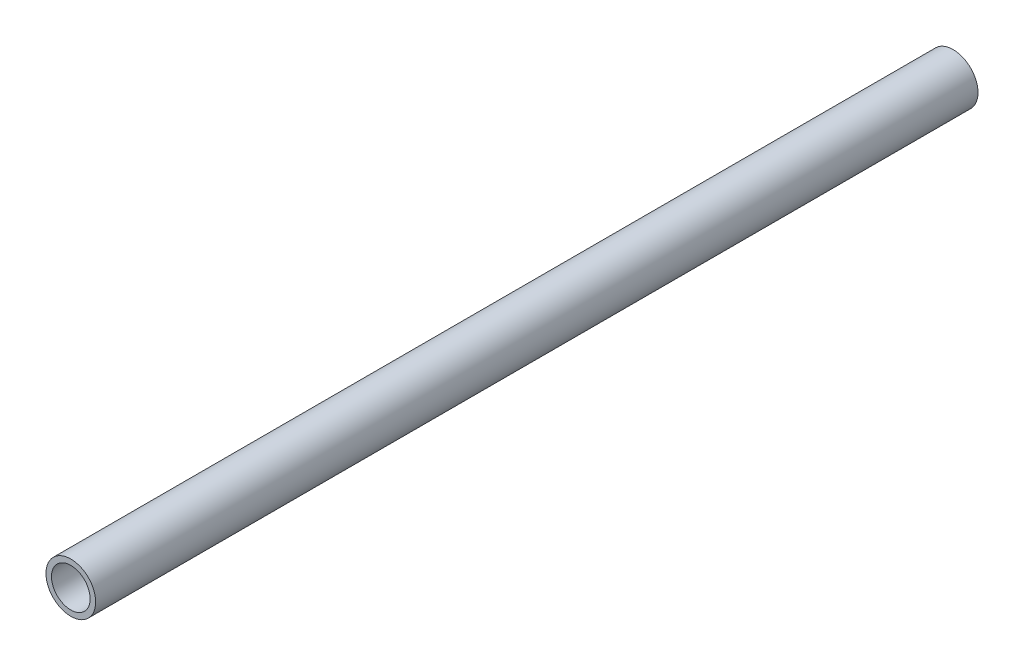
from build123d import *

# Parameters (mm, degrees)
SKETCH1_R           = 9
SKETCH1_R_2         = 7
BOSS_EXTRUDE1_DEPTH = 319.6


with BuildPart() as part:
    # Sketch1 → Boss-Extrude1 (new body)
    with BuildSketch(Plane.XY):
        Circle(SKETCH1_R)
        Circle(SKETCH1_R_2, mode=Mode.SUBTRACT)
    extrude(amount=BOSS_EXTRUDE1_DEPTH)


solid = part.part
